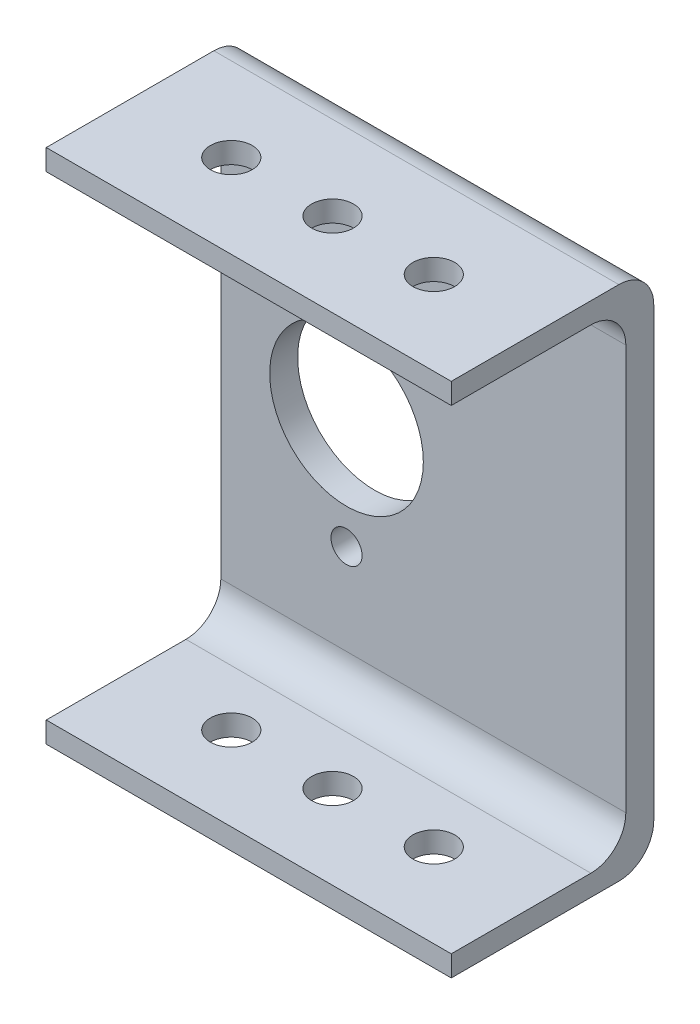
from build123d import *

# Parameters (mm, degrees)
SKETCH3_R           = 11
BOSS_EXTRUDE1_DEPTH = 4
SKETCH5_W           = 58
SKETCH5_H           = 3
BOSS_EXTRUDE2_DEPTH = 25
FILLET1_R           = 5
SKETCH6_R           = 3
CUT_EXTRUDE1_DEPTH  = 89.532479916
SKETCH7_R           = 2.225
CUT_EXTRUDE2_DEPTH  = 62.081912216


with BuildPart() as part:
    # Sketch3 → Boss-Extrude1 (new body)
    with BuildSketch(Plane.XY):
        Polygon((-19, 37), (39, 37), (39, 0), (39, -37), (-19, -37), (-19, 0), align=None)
        with Locations((-1, 0)):
            Circle(SKETCH3_R, mode=Mode.SUBTRACT)
    extrude(amount=BOSS_EXTRUDE1_DEPTH)

    # Sketch5 → Boss-Extrude2 (add)
    with BuildSketch(Plane.XY.offset(4)):
        with Locations((10, 35.5)):
            Rectangle(SKETCH5_W, SKETCH5_H)
        with Locations((10, -35.5)):
            Rectangle(SKETCH5_W, SKETCH5_H)
    extrude(amount=BOSS_EXTRUDE2_DEPTH)

    # Fillet1
    fillet1_edges = [part.edges().sort_by_distance(p)[0] for p in [
        (10, 34, 4),
        (10, -34, 4),
        (10, -37, 0),
        (10, 37, 0),
    ]]
    fillet(fillet1_edges, radius=FILLET1_R)

    # Sketch6 → Cut-Extrude1 (cut, through all)
    with BuildSketch(Plane.XZ.offset(37)):
        with Locations(Location((24.5, 17, 0), (0, 0, 270))):
            Circle(SKETCH6_R)
        with Locations(Location((-4.5, 17, 0), (0, 0, 270))):
            Circle(SKETCH6_R)
        with Locations(Location((10, 17, 0), (0, 0, 270))):
            Circle(SKETCH6_R)
    extrude(amount=-CUT_EXTRUDE1_DEPTH, mode=Mode.SUBTRACT)

    # Sketch7 → Cut-Extrude2 (cut, through all)
    with BuildSketch(Plane(origin=(0, 0, 0), x_dir=(-1, 0, 0), z_dir=(0, 0, -1))):
        with Locations((1, -16)):
            Circle(SKETCH7_R)
        with Locations((1, 16)):
            Circle(SKETCH7_R)
    extrude(amount=-CUT_EXTRUDE2_DEPTH, mode=Mode.SUBTRACT)


solid = part.part
